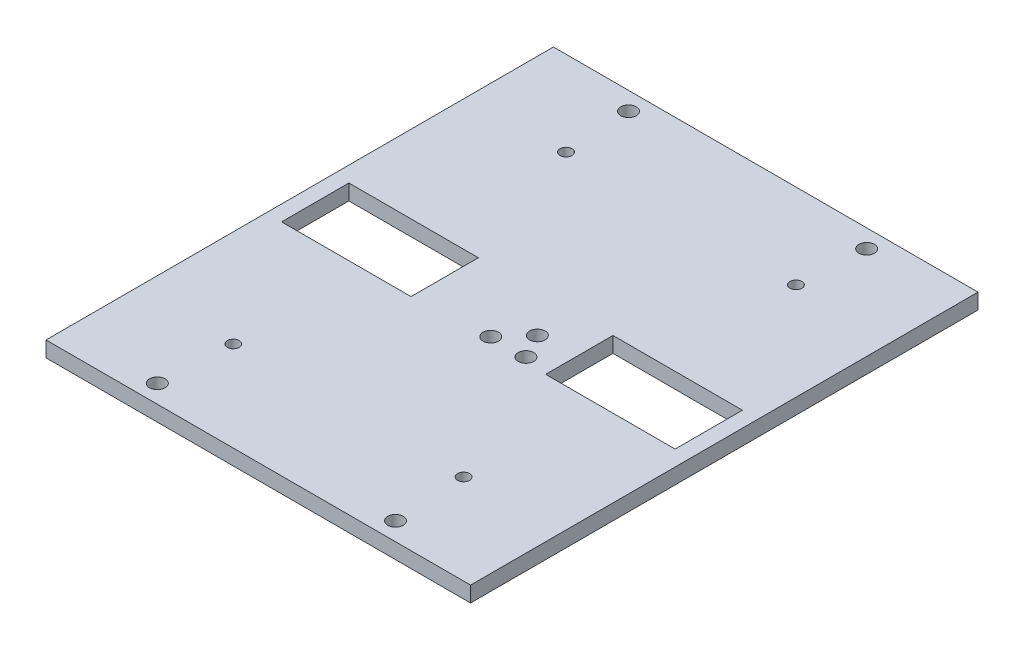
from build123d import *

# Parameters (mm, degrees)
SKETCH1_W                      = 82
SKETCH1_H                      = 98
BOSS_EXTRUDE1_DEPTH            = 3
F_3_0_3_DIAMETER_HOLE1_D       = 3
F_3_0_3_DIAMETER_HOLE1_DEPTH   = 30
SKETCH5_W                      = 25
SKETCH5_H                      = 13
CUT_EXTRUDE1_DEPTH             = 10
F_2_3_2_3_DIAMETER_HOLE1_D     = 2.3
F_2_3_2_3_DIAMETER_HOLE1_DEPTH = 30
SKETCH8_R                      = 1.5
CUT_EXTRUDE2_DEPTH             = 10
F_3_0_3_DIAMETER_HOLE2_D       = 3
F_3_0_3_DIAMETER_HOLE2_DEPTH   = 6.5


with BuildPart() as part:
    # Sketch1 → Boss-Extrude1 (new body)
    with BuildSketch(Plane(origin=(0, 0, 0), x_dir=(1, 0, 0), z_dir=(0, 1, 0))):
        Rectangle(SKETCH1_W, SKETCH1_H)
    extrude(amount=BOSS_EXTRUDE1_DEPTH)

    # Ø3.0 (3) Diameter Hole1
    with Locations(Plane(origin=(0, 0, 0), x_dir=(-1, 0, 0), z_dir=(0, -1, 0))):
        with Locations((23, -45.5), (-23, -45.5), (-23, 45.5), (23, 45.5)):
            Hole(F_3_0_3_DIAMETER_HOLE1_D / 2, depth=F_3_0_3_DIAMETER_HOLE1_DEPTH)

    # Sketch5 → Cut-Extrude1 (cut)
    with BuildSketch(Plane.XZ):
        with Locations((-25.5, 0)):
            Rectangle(SKETCH5_W, SKETCH5_H)
        with Locations((25.5, 0)):
            Rectangle(SKETCH5_W, SKETCH5_H)
    extrude(amount=-CUT_EXTRUDE1_DEPTH, mode=Mode.SUBTRACT)

    # Ø2.3 (2.3) Diameter Hole1
    with Locations(Plane(origin=(0, 3, 0), x_dir=(1, 0, 0), z_dir=(0, 1, 0))):
        with Locations((-22.24500144, -31.590736692), (22.24500144, -31.590736692), (22.203117232, 32.633806534), (-22.203117232, 32.633806534)):
            Hole(F_2_3_2_3_DIAMETER_HOLE1_D / 2, depth=F_2_3_2_3_DIAMETER_HOLE1_DEPTH)

    # Sketch8 → Cut-Extrude2 (cut)
    with BuildSketch(Plane.XZ):
        with Locations(Location((5.7, 0.8, 0), (0, 0, 270))):
            Circle(SKETCH8_R)
    extrude(amount=-CUT_EXTRUDE2_DEPTH, mode=Mode.SUBTRACT)

    # Ø3.0 (3) Diameter Hole2
    with Locations(Plane(origin=(0, 0, 0), x_dir=(-1, 0, 0), z_dir=(0, -1, 0))):
        with Locations((-1.4, -5.5), (-8.2, -5.5)):
            Hole(F_3_0_3_DIAMETER_HOLE2_D / 2, depth=F_3_0_3_DIAMETER_HOLE2_DEPTH)


solid = part.part
